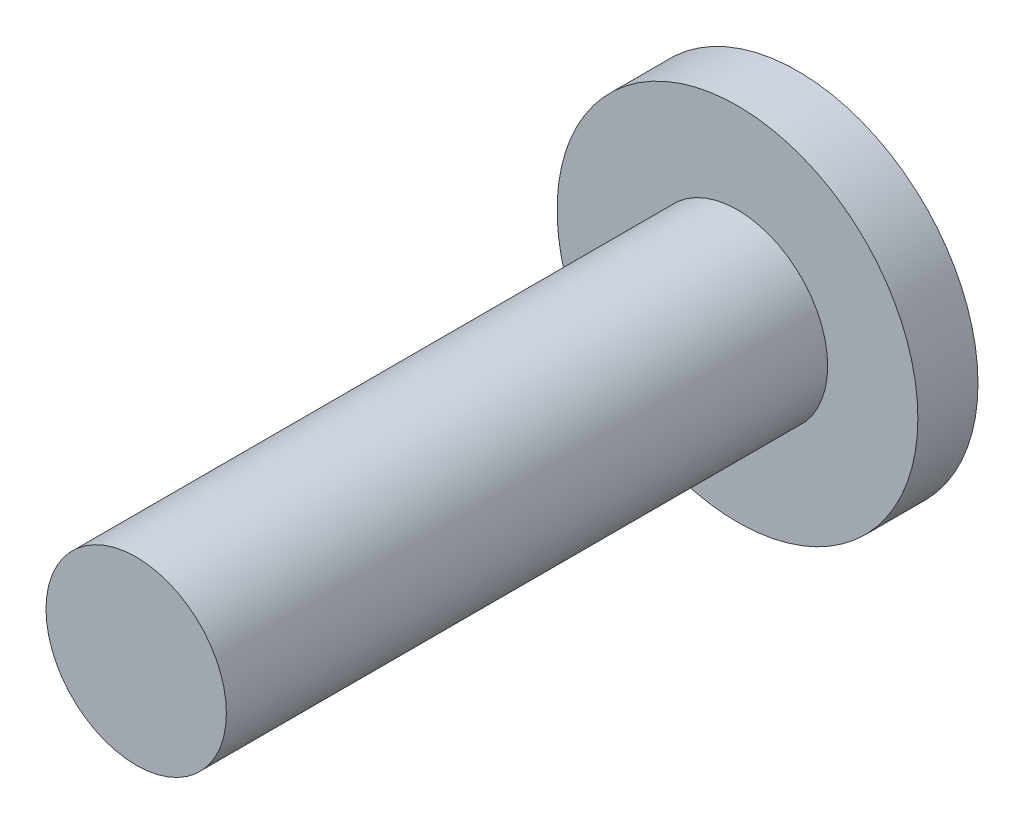
from build123d import *

# Parameters (mm, degrees)
SKETCH_1_R      = 3
EXTRUDE_1_DEPTH = 1
SKETCH_2_R      = 1.5
EXTRUDE_2_DEPTH = 10


with BuildPart() as part:
    # 草图1 → 凸台-拉伸1 (new body)
    with BuildSketch(Plane.XY):
        Circle(SKETCH_1_R)
    extrude(amount=EXTRUDE_1_DEPTH)

    # 草图2 → 凸台-拉伸2 (add)
    with BuildSketch(Plane.XY.offset(1)):
        Circle(SKETCH_2_R)
    extrude(amount=EXTRUDE_2_DEPTH)


solid = part.part
